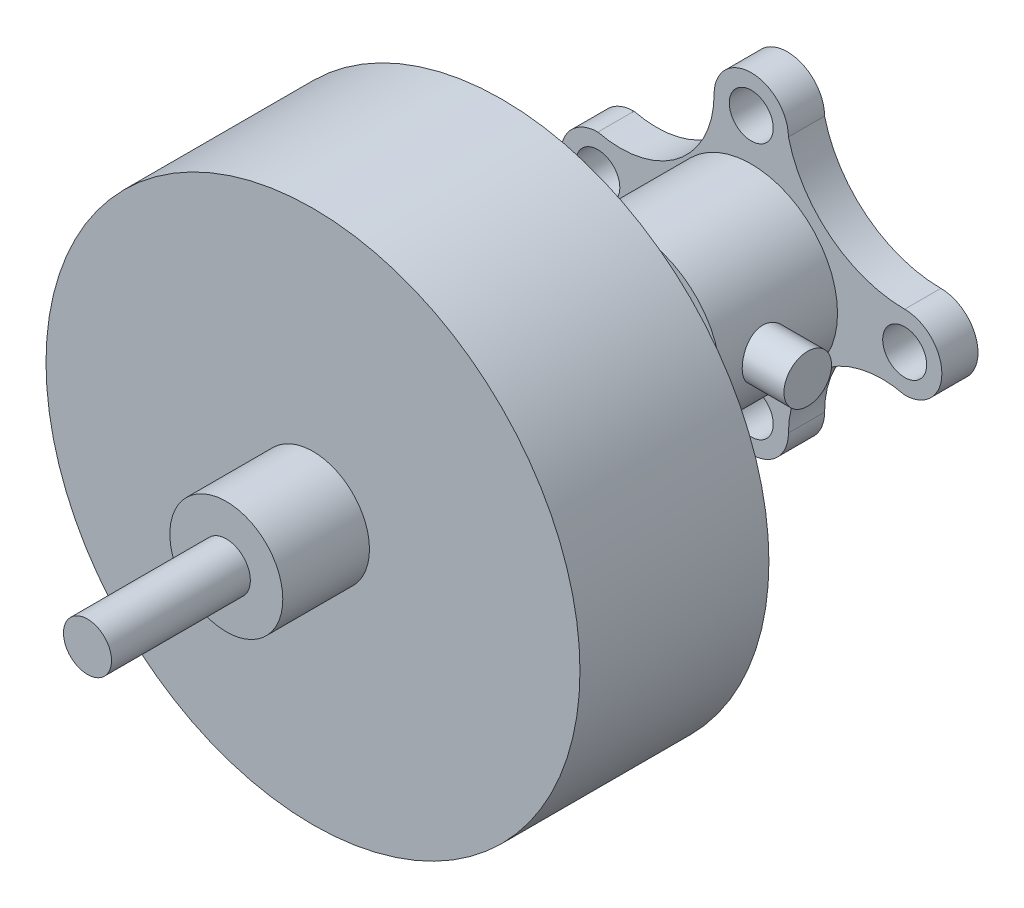
from build123d import *

# Parameters (mm, degrees)
SKETCH1_R                = 1.3589
BOSS_EXTRUDE1_DEPTH      = 2.2352
SKETCH2_R                = 5.334
BOSS_EXTRUDE2_DEPTH      = 7.2136
BOSS_EXTRUDE3_DEPTH      = 7.9121
BOSS_EXTRUDE3_DEPTH_BACK = 7.9121
SKETCH3_R                = 1.4732
SKETCH4_R                = 3.96875
BOSS_EXTRUDE4_DEPTH      = 8.2042
SKETCH5_R                = 16.51
BOSS_EXTRUDE5_DEPTH      = 11.684
SKETCH6_R                = 3.4925
BOSS_EXTRUDE6_DEPTH      = 5.3594
SKETCH7_R                = 1.4859
BOSS_EXTRUDE7_DEPTH      = 8.5852


with BuildPart() as part:
    # Sketch1 → Boss-Extrude1 (new body)
    with BuildSketch(Plane.XY):
        with BuildLine():
            ThreePointArc((2.2987, -7.9248), (4.217475252, -3.616655942), (8.703337155, -2.161030069))
            ThreePointArc((8.703337155, -2.161030069), (9.097483524, -2.216404696), (9.4869, -2.2987))
            ThreePointArc((9.4869, -2.2987), (11.7856, 0), (9.4869, 2.2987))
            ThreePointArc((9.4869, 2.2987), (4.922822315, 3.872455712), (2.2987, 7.9248))
            ThreePointArc((2.2987, 7.9248), (0, 10.2235), (-2.2987, 7.9248))
            ThreePointArc((-2.2987, 7.9248), (-4.217475252, 3.616655942), (-8.703337155, 2.161030069))
            ThreePointArc((-8.703337155, 2.161030069), (-9.097483524, 2.216404696), (-9.4869, 2.2987))
            ThreePointArc((-9.4869, 2.2987), (-11.7856, 0), (-9.4869, -2.2987))
            ThreePointArc((-9.4869, -2.2987), (-4.922822315, -3.872455712), (-2.2987, -7.9248))
            ThreePointArc((-2.2987, -7.9248), (0, -10.2235), (2.2987, -7.9248))
        make_face()
        with Locations((0, -7.9248)):
            Circle(SKETCH1_R, mode=Mode.SUBTRACT)
        with Locations((-9.4869, 0)):
            Circle(SKETCH1_R, mode=Mode.SUBTRACT)
        with Locations((0, 7.9248)):
            Circle(SKETCH1_R, mode=Mode.SUBTRACT)
        with Locations((9.4869, 0)):
            Circle(SKETCH1_R, mode=Mode.SUBTRACT)
    extrude(amount=BOSS_EXTRUDE1_DEPTH)

    # Sketch2 → Boss-Extrude2 (add)
    with BuildSketch(Plane.XY.offset(2.2352)):
        Circle(SKETCH2_R)
    extrude(amount=BOSS_EXTRUDE2_DEPTH)

    # Sketch3 → Boss-Extrude3 (add, two sides: drawn at the far end of the back side and taken through both)
    with BuildSketch(Plane(origin=(0, 0, 0), x_dir=(0, 0, -1), z_dir=(1, 0, 0)).offset(-BOSS_EXTRUDE3_DEPTH_BACK)):
        with Locations((-6.6548, 0)):
            Circle(SKETCH3_R)
    extrude(amount=BOSS_EXTRUDE3_DEPTH + BOSS_EXTRUDE3_DEPTH_BACK)

    # Sketch4 → Boss-Extrude4 (add)
    with BuildSketch(Plane.XY.offset(9.4488)):
        Circle(SKETCH4_R)
    extrude(amount=BOSS_EXTRUDE4_DEPTH)

    # Sketch5 → Boss-Extrude5 (add)
    with BuildSketch(Plane.XY.offset(17.653)):
        Circle(SKETCH5_R)
    extrude(amount=BOSS_EXTRUDE5_DEPTH)

    # Sketch6 → Boss-Extrude6 (add)
    with BuildSketch(Plane.XY.offset(29.337)):
        Circle(SKETCH6_R)
    extrude(amount=BOSS_EXTRUDE6_DEPTH)

    # Sketch7 → Boss-Extrude7 (add)
    with BuildSketch(Plane.XY.offset(34.6964)):
        Circle(SKETCH7_R)
    extrude(amount=BOSS_EXTRUDE7_DEPTH)


solid = part.part
